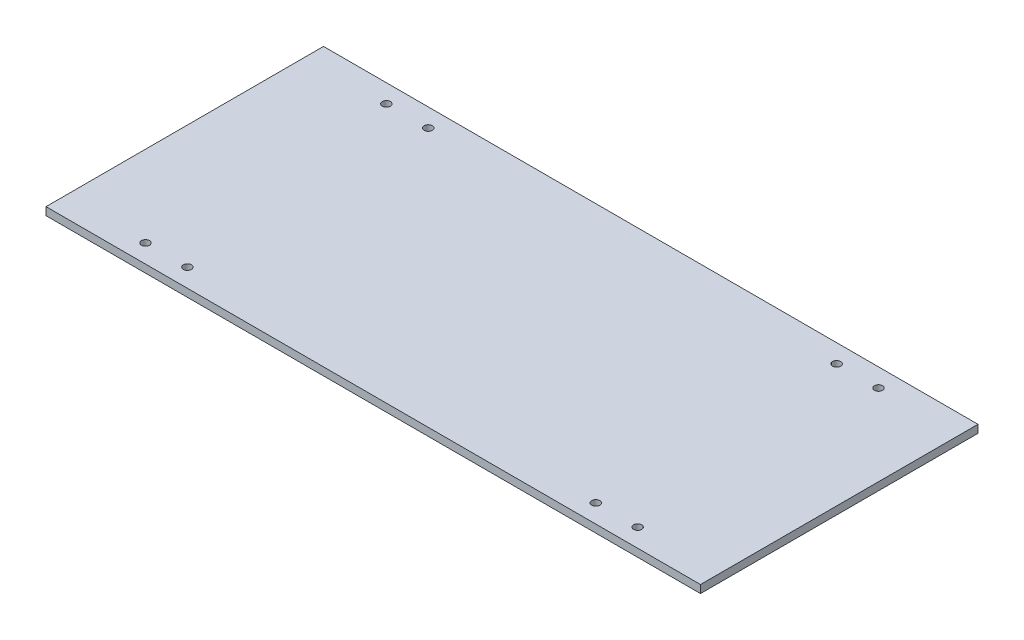
from build123d import *

# Parameters (mm, degrees)
SKETCH1_W           = 250
SKETCH1_H           = 106
SKETCH1_R           = 1.55
BOSS_EXTRUDE1_DEPTH = 3


with BuildPart() as part:
    # Sketch1 → Boss-Extrude1 (new body)
    with BuildSketch(Plane(origin=(0, 0, 0), x_dir=(1, 0, 0), z_dir=(0, 1, 0))):
        with Locations((125, 53)):
            Rectangle(SKETCH1_W, SKETCH1_H)
        with Locations(Location((31, 99, 0), (0, 0, 270))):
            Circle(SKETCH1_R, mode=Mode.SUBTRACT)
        with Locations(Location((47, 99, 0), (0, 0, 270))):
            Circle(SKETCH1_R, mode=Mode.SUBTRACT)
        with Locations(Location((203, 99, 0), (0, 0, 90))):
            Circle(SKETCH1_R, mode=Mode.SUBTRACT)
        with Locations(Location((219, 99, 0), (0, 0, 90))):
            Circle(SKETCH1_R, mode=Mode.SUBTRACT)
        with Locations(Location((219, 7, 0), (0, 0, 270))):
            Circle(SKETCH1_R, mode=Mode.SUBTRACT)
        with Locations(Location((203, 7, 0), (0, 0, 270))):
            Circle(SKETCH1_R, mode=Mode.SUBTRACT)
        with Locations(Location((47, 7, 0), (0, 0, 90))):
            Circle(SKETCH1_R, mode=Mode.SUBTRACT)
        with Locations(Location((31, 7, 0), (0, 0, 90))):
            Circle(SKETCH1_R, mode=Mode.SUBTRACT)
    extrude(amount=BOSS_EXTRUDE1_DEPTH)


solid = part.part
